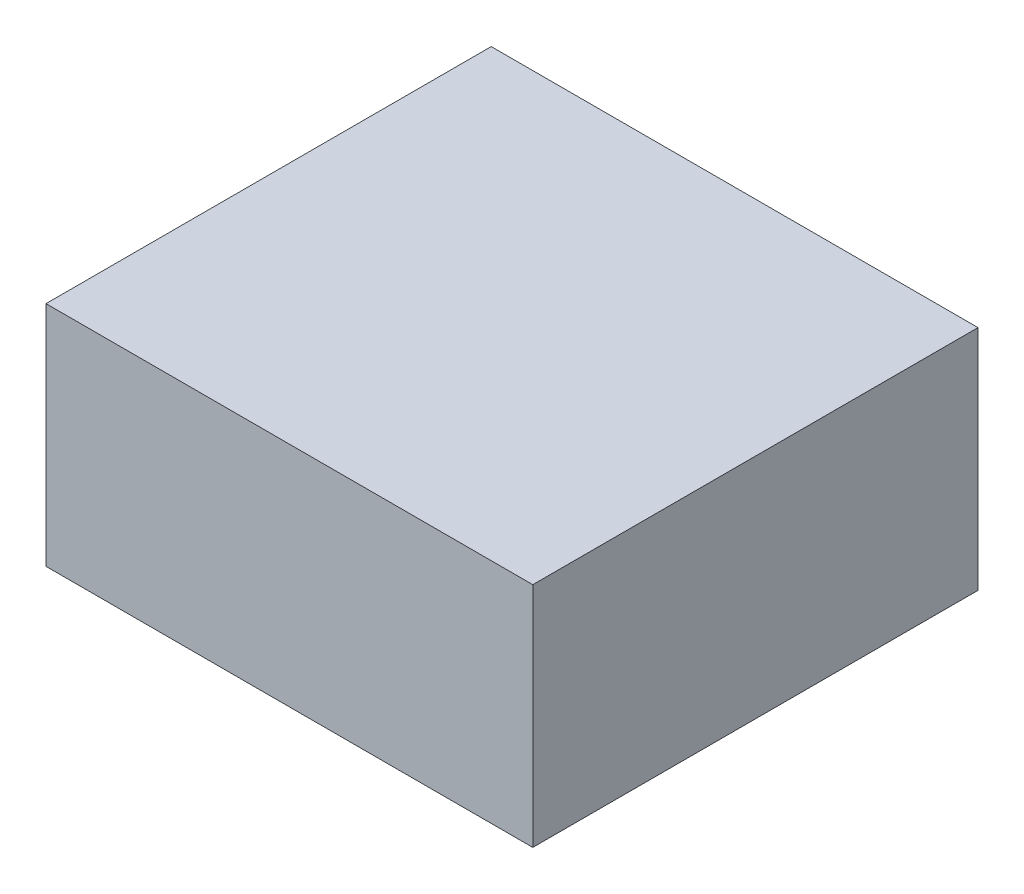
from build123d import *

# Parameters (mm, degrees)
SCHIZZO1_W                   = 24.6
SCHIZZO1_H                   = 22.5
ESTRUSIONE_ESTRUSIONE1_DEPTH = 11.5


with BuildPart() as part:
    # Schizzo1 → Estrusione-Estrusione1 (new body)
    with BuildSketch(Plane(origin=(0, 0, 0), x_dir=(1, 0, 0), z_dir=(0, 1, 0))):
        Rectangle(SCHIZZO1_W, SCHIZZO1_H)
    extrude(amount=ESTRUSIONE_ESTRUSIONE1_DEPTH)


solid = part.part
